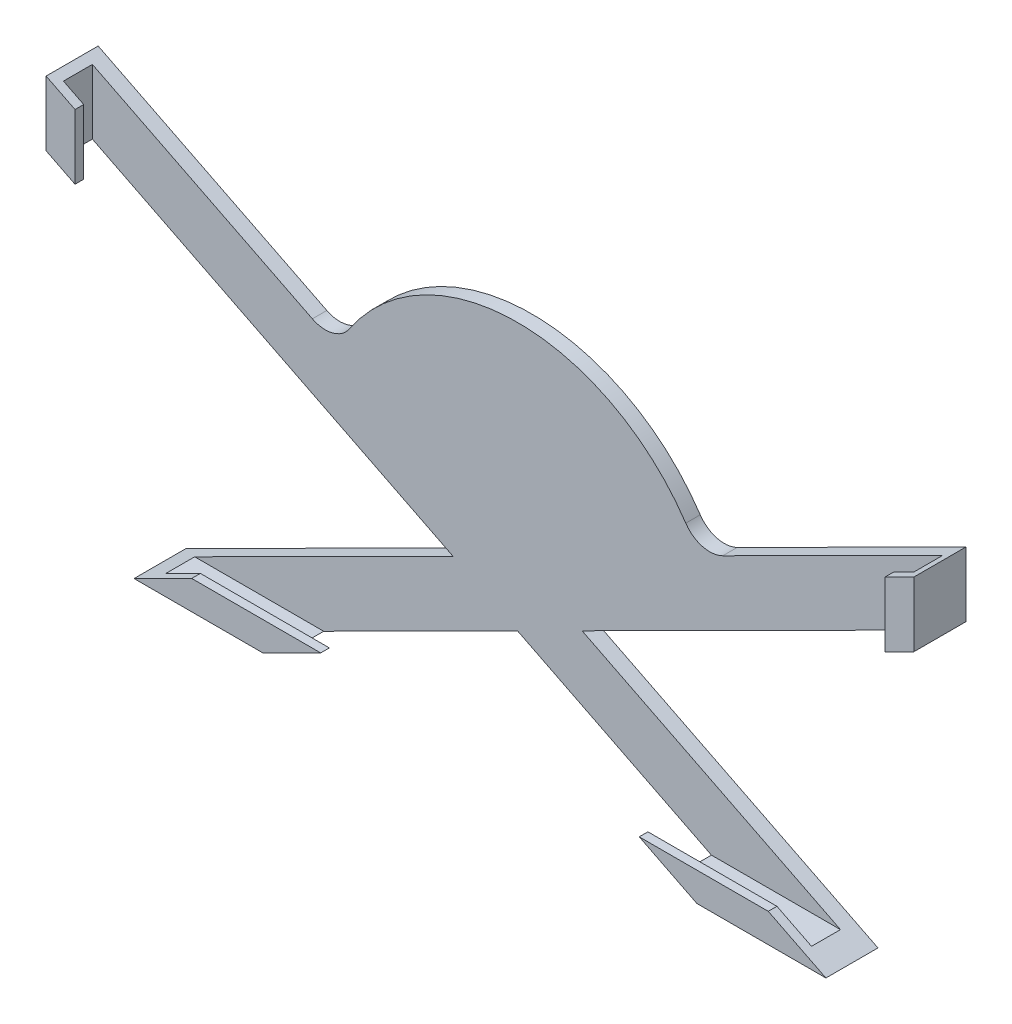
from build123d import *

# Parameters (mm, degrees)
BOSS_EXTRUDE1_DEPTH = 5
BOSS_EXTRUDE2_DEPTH = 10
BOSS_EXTRUDE3_DEPTH = 3
BOSS_EXTRUDE4_DEPTH = 5
FILLET1_R           = 10


with BuildPart() as part:
    # Sketch1 → Boss-Extrude1 (new body)
    with BuildSketch(Plane.XY):
        Polygon((-150, 75.248916092), (0, 0), (150, 75.248916092), (150, 52.873374138), (22.301525839, -11.187770977), (119.603051678, -60), (75, -60), (0, -22.375541954), (-75, -60), (-119.603051678, -60), (-22.301525839, -11.187770977), (-150, 52.873374138), align=None)
    extrude(amount=BOSS_EXTRUDE1_DEPTH)

    # Sketch2 → Boss-Extrude2 (add)
    with BuildSketch(Plane.XY.offset(5)):
        Polygon((-150, 75.248916092), (-150, 52.873374138), (-147, 51.368395816), (-147, 73.74393777), align=None)
        Polygon((150, 75.248916092), (147, 73.74393777), (147, 51.368395816), (150, 52.873374138), align=None)
        Polygon((119.603051678, -60), (111.629514899, -56), (67.026463221, -56), (75, -60), align=None)
        Polygon((-75, -60), (-119.603051678, -60), (-111.629514899, -56), (-67.026463221, -56), align=None)
    extrude(amount=BOSS_EXTRUDE2_DEPTH)

    # Sketch3 → Boss-Extrude3 (add)
    with BuildSketch(Plane.XY.offset(15)):
        Polygon((-150, 75.248916092), (-150, 52.873374138), (-140, 47.856779731), (-140, 70.232321686), align=None)
        Polygon((-75, -60), (-55.066158054, -50), (-99.669209731, -50), (-119.603051678, -60), align=None)
        Polygon((75, -60), (119.603051678, -60), (99.669209731, -50), (55.066158054, -50), align=None)
        Polygon((150, 75.248916092), (140, 70.232321686), (140, 47.856779731), (150, 52.873374138), align=None)
    extrude(amount=BOSS_EXTRUDE3_DEPTH)

    # Sketch4 → Boss-Extrude4 (add)
    with BuildSketch(Plane.XY):
        with BuildLine():
            Line((-62.568316909, 31.387986861), (0, 0))
            Line((0, 0), (62.568316909, 31.387986861))
            ThreePointArc((62.568316909, 31.387986861), (0, 70), (-62.568316909, 31.387986861))
        make_face()
    extrude(amount=BOSS_EXTRUDE4_DEPTH)

    # Fillet1
    fillet1_edges = [part.edges().sort_by_distance(p)[0] for p in [
        (62.568316909, 31.387986861, 2.5),
        (-62.568316909, 31.387986861, 2.5),
    ]]
    fillet(fillet1_edges, radius=FILLET1_R)


solid = part.part
